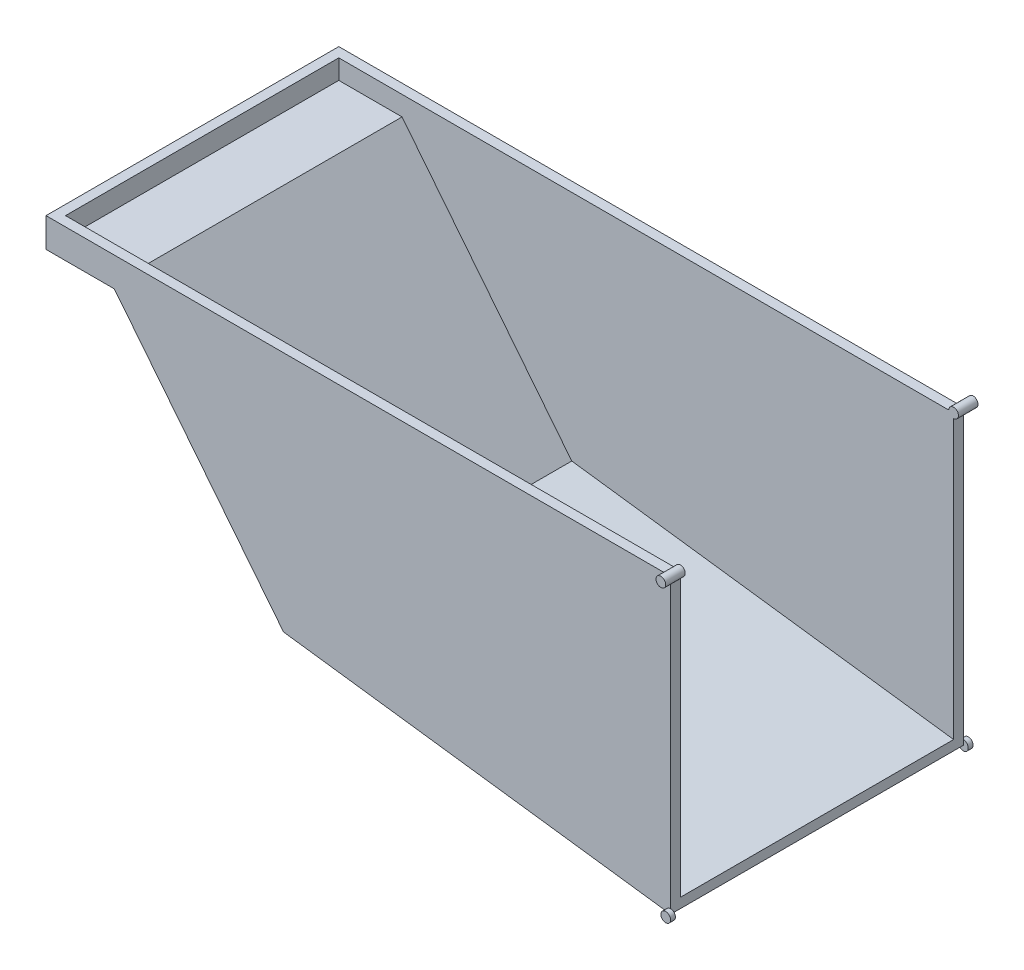
from build123d import *

# Parameters (mm, degrees)
BOSS_EXTRUDE2_DEPTH      = 150
SHELL1_T                 = -5
BOSS_EXTRUDE4_DEPTH      = 5
BOSS_EXTRUDE4_DEPTH_BACK = 5
SKETCH2_R                = 2.5
BOSS_EXTRUDE5_DEPTH      = 5
BOSS_EXTRUDE5_DEPTH_BACK = 5
SKETCH3_R                = 2.5
SKETCH4_R                = 2.5
BOSS_EXTRUDE7_DEPTH      = 2.5
BOSS_EXTRUDE8_DEPTH      = 5.5
SKETCH7_R                = 0.75
CUT_EXTRUDE1_DEPTH       = 5.5


with BuildPart() as part:
    # Sketch1 → Boss-Extrude2 (new body)
    with BuildSketch(Plane.XY):
        Polygon((0, 150), (0, 135), (35, 135), (121.711027725, 26.105238444), (320, 0), (320, 150), align=None)
    extrude(amount=BOSS_EXTRUDE2_DEPTH)

    # Shell1
    shell1_openings = [part.faces().sort_by_distance(p)[0] for p in [
        (160, 150, 75),
        (320, 75, 75),
    ]]
    offset(amount=SHELL1_T, openings=shell1_openings, kind=Kind.INTERSECTION)

    # Sketch2 → Boss-Extrude4 (add, two sides: drawn at the far end of the back side and taken through both)
    with BuildSketch(Plane.XY.offset(150).offset(-BOSS_EXTRUDE4_DEPTH_BACK)):
        with Locations((320, 150)):
            Circle(SKETCH2_R)
    extrude(amount=BOSS_EXTRUDE4_DEPTH + BOSS_EXTRUDE4_DEPTH_BACK)

    # Sketch3 → Boss-Extrude5 (add, two sides: drawn at the far end of the back side and taken through both)
    with BuildSketch(Plane(origin=(0, 0, 0), x_dir=(-1, 0, 0), z_dir=(0, 0, -1)).offset(-BOSS_EXTRUDE5_DEPTH_BACK)):
        with Locations(Location((-320, 150, 0), (0, 0, 180))):
            Circle(SKETCH3_R)
    extrude(amount=BOSS_EXTRUDE5_DEPTH + BOSS_EXTRUDE5_DEPTH_BACK)

    # Sketch4 → Boss-Extrude7 (add)
    with BuildSketch(Plane.XY.offset(150)):
        with Locations(Location((320, 0, 0), (0, 0, 172.5))):
            Circle(SKETCH4_R)
    boss_extrude7 = extrude(amount=BOSS_EXTRUDE7_DEPTH)

    # Mirror1: Boss-Extrude7 across plane
    add(boss_extrude7.mirror(Plane.XY.offset(75)))

    # Sketch6 → Boss-Extrude8 (add)
    with BuildSketch(Plane.XZ.offset(-135)):
        Polygon((17.733333333, 74), (17.266666667, 76), (16.25, 76), (16.25, 74), align=None)
        Polygon((18.75, 76), (17.266666667, 76), (17.733333333, 74), (18.75, 74), align=None)
    extrude(amount=BOSS_EXTRUDE8_DEPTH)

    # Sketch7 → Cut-Extrude1 (cut)
    with BuildSketch(Plane.XY.offset(76)):
        with Locations((17.5, 131)):
            Circle(SKETCH7_R)
        with BuildLine():
            Line((16.25, 135), (16.501917688, 130.938099278))
            ThreePointArc((16.501917688, 130.938099278), (17.5, 130), (18.498082312, 130.938099278))
            Line((18.498082312, 130.938099278), (18.75, 135))
            Line((18.75, 135), (18.75, 129.5))
            Line((18.75, 129.5), (16.25, 129.5))
            Line((16.25, 129.5), (16.25, 135))
        make_face()
    extrude(amount=-CUT_EXTRUDE1_DEPTH, mode=Mode.SUBTRACT)


solid = part.part
